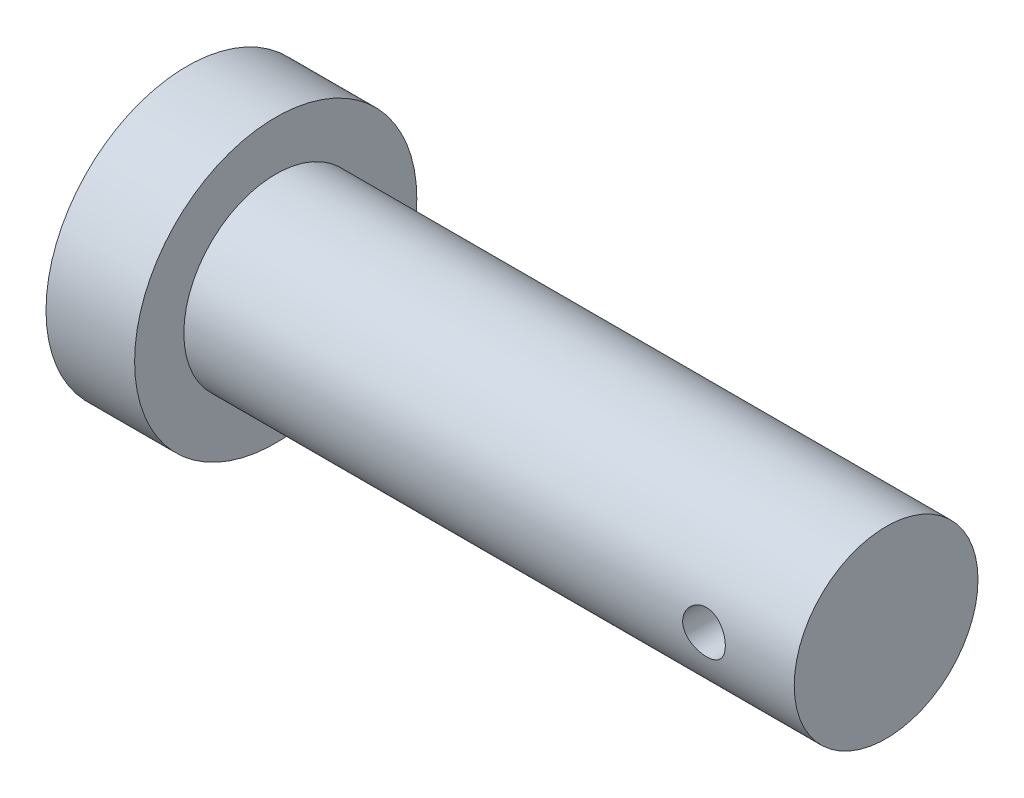
from build123d import *

# Parameters (mm, degrees)
SKETCH3_R          = 6.5
CUT_EXTRUDE1_DEPTH = 40


with BuildPart() as part:
    # Sketch2 → Revolve1 (revolve)
    with BuildSketch(Plane.XY, mode=Mode.PRIVATE) as revolve1_sk:
        Polygon((0, 0), (0, 43), (27, 43), (27, 28), (213, 28), (213, 0), align=None)
    revolve(revolve1_sk.sketch.rotate(Axis((0, 0, 0), (1, 0, 0)), 90), axis=Axis((0, 0, 0), (1, 0, 0)))

    # Sketch3 → Cut-Extrude1 (cut, symmetric)
    with BuildSketch(Plane.XY):
        with Locations((185.5, 0)):
            Circle(SKETCH3_R)
    extrude(amount=CUT_EXTRUDE1_DEPTH, both=True, mode=Mode.SUBTRACT)


solid = part.part
